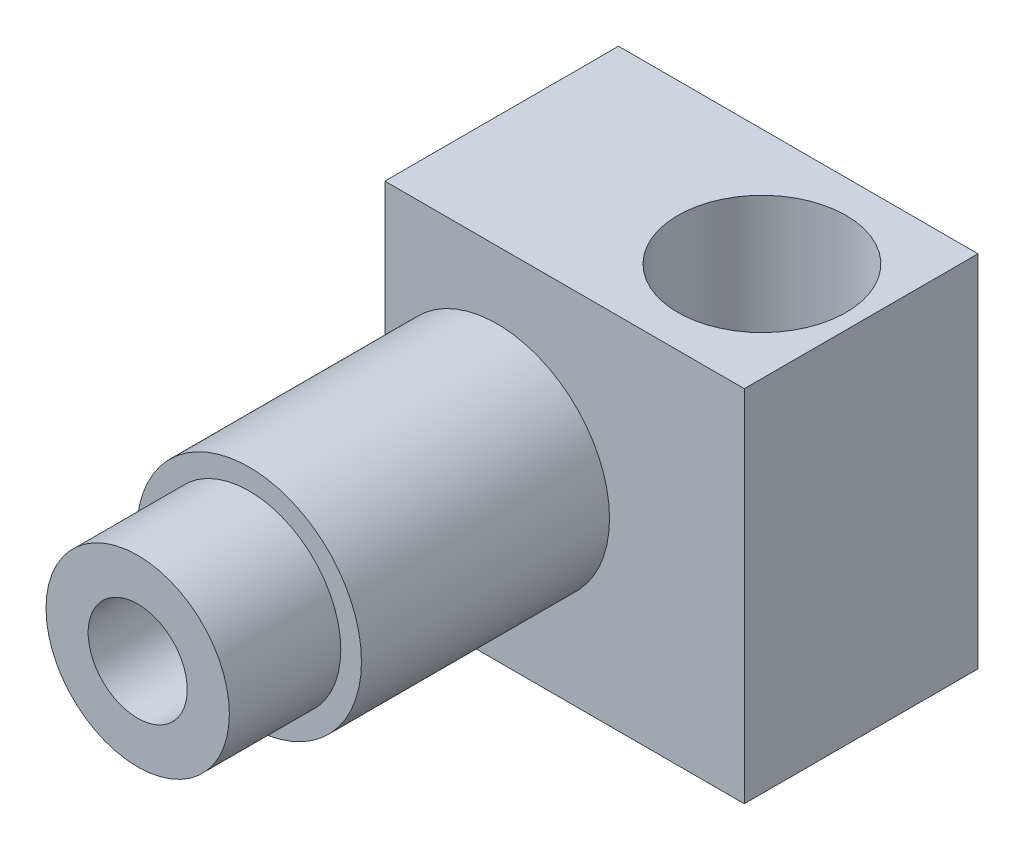
from build123d import *

# Parameters (mm, degrees)
SKETCH1_W                      = 12.7
SKETCH1_H                      = 12.7
BOSS_EXTRUDE1_DEPTH            = 4.1275
SKETCH2_R                      = 2.9718
CUT_EXTRUDE1_DEPTH             = 15.786776398
SKETCH3_R                      = 3.96875
BOSS_EXTRUDE2_DEPTH            = 12.7
SKETCH4_OUTSIDE_W              = 20.22
SKETCH4_OUTSIDE_H              = 20.22
SKETCH4_OUTSIDE_R              = 3.2385
CUT_EXTRUDE2_DEPTH             = 3.937
BOSS_EXTRUDE3_START            = 3.048
SKETCH5_R                      = 3.96875
BOSS_EXTRUDE3_DEPTH            = 3.048
CHAMFER1_SIZE                  = 1.75
CHAMFER1_SIZE2                 = 3.031088913
SKETCH6_R                      = 0.175
CUT_EXTRUDE3_DEPTH             = 26.627895134
F_3_5_3_5_DIAMETER_HOLE1_D     = 3.5
F_3_5_3_5_DIAMETER_HOLE1_DEPTH = 21
F_3_5_3_5_DIAMETER_HOLE1_TIP   = 1.051506083
SKETCH11_R                     = 1.143
CUT_EXTRUDE4_DEPTH             = 4


with BuildPart() as part:
    # Sketch1 → Boss-Extrude1 (new, symmetric)
    with BuildSketch(Plane.XY):
        Rectangle(SKETCH1_W, SKETCH1_H)
    extrude(amount=BOSS_EXTRUDE1_DEPTH, both=True)

    # Sketch2 → Cut-Extrude1 (cut, through all)
    with BuildSketch(Plane.XZ.offset(6.35)):
        with Locations(Location((2.8448, 0, 0), (0, 0, 270))):
            Circle(SKETCH2_R)
    extrude(amount=-CUT_EXTRUDE1_DEPTH, mode=Mode.SUBTRACT)

    # Sketch3 → Boss-Extrude2 (add)
    with BuildSketch(Plane.XY.offset(4.1275)):
        with Locations(Location((-2.38125, 0, 0), (0, 0, 180))):
            Circle(SKETCH3_R)
    extrude(amount=BOSS_EXTRUDE2_DEPTH)

    # Sketch4 outside → Cut-Extrude2 (cut)
    with BuildSketch(Plane.XY.offset(16.8275)):
        Rectangle(SKETCH4_OUTSIDE_W, SKETCH4_OUTSIDE_H)
        with Locations((-2.38125, 0)):
            Circle(SKETCH4_OUTSIDE_R, mode=Mode.SUBTRACT)
    extrude(amount=-CUT_EXTRUDE2_DEPTH, mode=Mode.SUBTRACT)

    # Sketch5 → Boss-Extrude3 (add)
    with BuildSketch(Plane(origin=(0, 0, -4.1275), x_dir=(-1, 0, 0), z_dir=(0, 0, -1)).offset(BOSS_EXTRUDE3_START)):
        with Locations((2.38125, 0)):
            Circle(SKETCH5_R)
    extrude(amount=-BOSS_EXTRUDE3_DEPTH)

    # Chamfer1
    chamfer1_edges = [part.edges().sort_by_distance(p)[0] for p in [
        (1.5875, 0, -7.1755),
    ]]
    chamfer1_side = [part.faces().sort_by_distance(p)[0] for p in [
        (1.5875, 0, -5.6515),
    ]]
    chamfer(chamfer1_edges, length=CHAMFER1_SIZE, length2=CHAMFER1_SIZE2, reference=chamfer1_side[0])

    # Sketch6 → Cut-Extrude3 (cut, through all)
    with BuildSketch(Plane(origin=(0, 0, -7.1755), x_dir=(-1, 0, 0), z_dir=(0, 0, -1))):
        with Locations((2.38125, 0)):
            Circle(SKETCH6_R)
    extrude(amount=-CUT_EXTRUDE3_DEPTH, mode=Mode.SUBTRACT)

    # Ø3.5 (3.5) Diameter Hole1
    with Locations(Plane.XY.offset(16.8275)):
        with Locations((-2.38125, 0)):
            Hole(F_3_5_3_5_DIAMETER_HOLE1_D / 2, depth=F_3_5_3_5_DIAMETER_HOLE1_DEPTH)
            with Locations((0, 0, -(F_3_5_3_5_DIAMETER_HOLE1_DEPTH + F_3_5_3_5_DIAMETER_HOLE1_TIP / 2))):  # 118° drill point
                Cone(0, F_3_5_3_5_DIAMETER_HOLE1_D / 2, F_3_5_3_5_DIAMETER_HOLE1_TIP, mode=Mode.SUBTRACT)

    # Sketch11 → Cut-Extrude4 (cut)
    with BuildSketch(Plane.ZY.offset(6.35)):
        with Locations((-0.8725, 4.35)):
            Circle(SKETCH11_R)
    extrude(amount=-CUT_EXTRUDE4_DEPTH, mode=Mode.SUBTRACT)


solid = part.part
